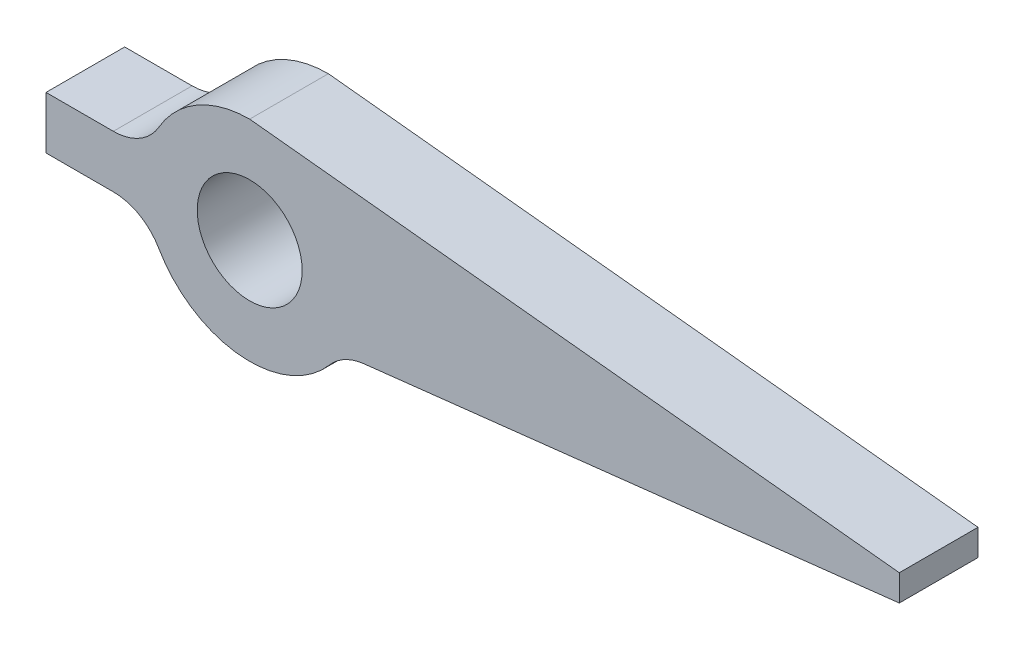
from build123d import *

# Parameters (mm, degrees)
SKETCH1_R           = 1
BOSS_EXTRUDE1_DEPTH = 1.5
FILLET1_R           = 1
FILLET2_R           = 1
FILLET3_R           = 1


with BuildPart() as part:
    # Sketch1 → Boss-Extrude1 (new body)
    with BuildSketch(Plane.XY):
        with BuildLine():
            Line((1.166287968, 16.85370801), (1.166287968, 17.354314772))
            Line((1.166287968, 17.354314772), (-11.216055041, 18.650494389))
            ThreePointArc((-11.216055041, 18.650494389), (-12.440799912, 18.231633219), (-13.152546714, 17.150494389))
            Line((-13.152546714, 17.150494389), (-15.098105849, 17.150494389))
            Line((-15.098105849, 17.150494389), (-15.098105849, 16.150494389))
            Line((-15.098105849, 16.150494389), (-13.152546714, 16.150494389))
            ThreePointArc((-13.152546714, 16.150494389), (-11.486145798, 14.66881556), (-9.484004234, 15.650494389))
            Line((-9.484004234, 15.650494389), (1.166287968, 16.85370801))
        make_face()
        with Locations((-11.216055041, 16.650494389)):
            Circle(SKETCH1_R, mode=Mode.SUBTRACT)
    extrude(amount=BOSS_EXTRUDE1_DEPTH)

    # Fillet1
    fillet1_edges = [part.edges().sort_by_distance(p)[0] for p in [
        (-13.152546714, 16.150494389, 0.75),
    ]]
    fillet(fillet1_edges, radius=FILLET1_R)

    # Fillet2
    fillet2_edges = [part.edges().sort_by_distance(p)[0] for p in [
        (-13.152546714, 17.150494389, 0.75),
    ]]
    fillet(fillet2_edges, radius=FILLET2_R)

    # Fillet3
    fillet3_edges = [part.edges().sort_by_distance(p)[0] for p in [
        (-9.484004234, 15.650494389, 0.75),
    ]]
    fillet(fillet3_edges, radius=FILLET3_R)


solid = part.part
